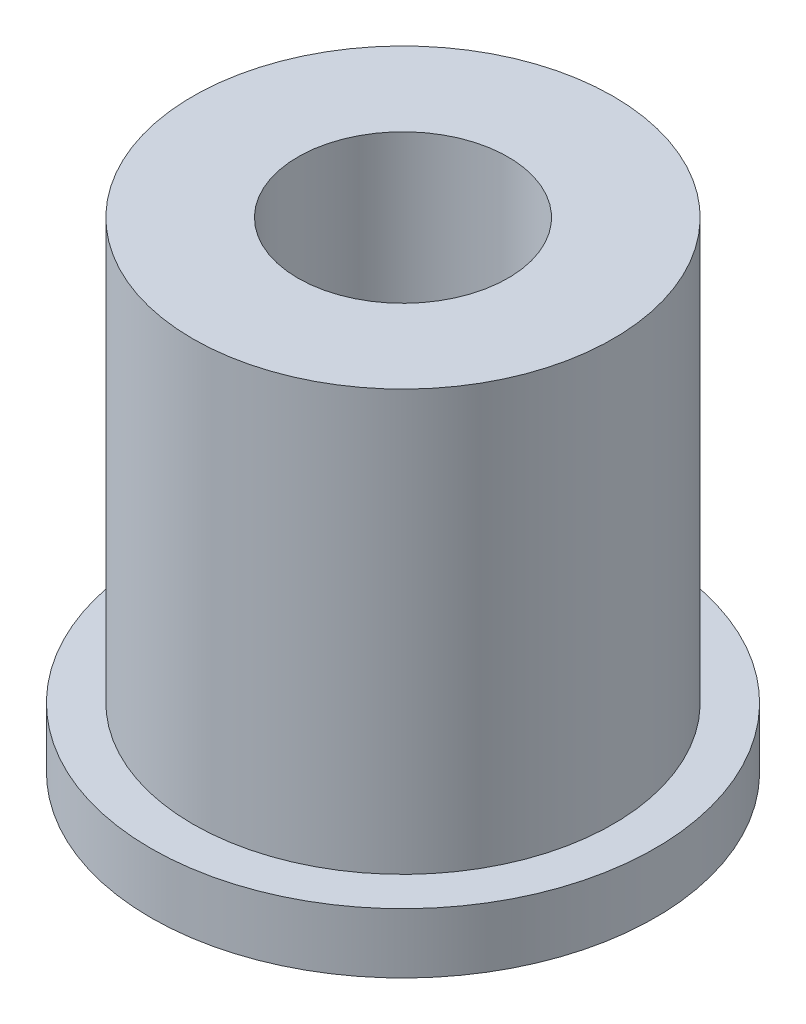
from build123d import *

# Parameters (mm, degrees)
SKETCH1_R           = 21
SKETCH1_R_2         = 8.75
BOSS_EXTRUDE1_DEPTH = 5
SKETCH2_R           = 2.1
SKETCH2_R_2         = 1.6
CUT_EXTRUDE1_DEPTH  = 5
SKETCH3_R           = 17.5
SKETCH3_R_2         = 8.75
BOSS_EXTRUDE2_DEPTH = 35


with BuildPart() as part:
    # Sketch1 → Boss-Extrude1 (new body)
    with BuildSketch(Plane(origin=(0, 0, 0), x_dir=(1, 0, 0), z_dir=(0, 1, 0))):
        with Locations(Location((0, 0, 0), (0, 0, 270))):
            Circle(SKETCH1_R)
        with Locations(Location((0, 0, 0), (0, 0, 270))):
            Circle(SKETCH1_R_2, mode=Mode.SUBTRACT)
    extrude(amount=BOSS_EXTRUDE1_DEPTH)

    # Sketch2 → Cut-Extrude1 (cut)
    with BuildSketch(Plane.XZ):
        with Locations(Location((-10.253048327, 10.253048327, 0), (0, 0, 270))):
            Circle(SKETCH2_R)
        with Locations(Location((10.253048327, -10.253048327, 0), (0, 0, 270))):
            Circle(SKETCH2_R)
        with Locations(Location((-15, 0, 0), (0, 0, 270))):
            Circle(SKETCH2_R_2)
        with Locations(Location((7.5, 12.990381057, 0), (0, 0, 270))):
            Circle(SKETCH2_R_2)
        with Locations(Location((7.5, -12.990381057, 0), (0, 0, 270))):
            Circle(SKETCH2_R_2)
        with Locations(Location((8.838834765, 8.838834765, 0), (0, 0, 270))):
            Circle(SKETCH2_R_2)
        with Locations(Location((-8.838834765, -8.838834765, 0), (0, 0, 270))):
            Circle(SKETCH2_R_2)
    extrude(amount=-CUT_EXTRUDE1_DEPTH, mode=Mode.SUBTRACT)

    # Sketch3 → Boss-Extrude2 (add)
    with BuildSketch(Plane(origin=(0, 5, 0), x_dir=(1, 0, 0), z_dir=(0, 1, 0))):
        with Locations(Location((0, 0, 0), (0, 0, 270))):
            Circle(SKETCH3_R)
        with Locations(Location((0, 0, 0), (0, 0, 270))):
            Circle(SKETCH3_R_2, mode=Mode.SUBTRACT)
    extrude(amount=BOSS_EXTRUDE2_DEPTH)


solid = part.part
